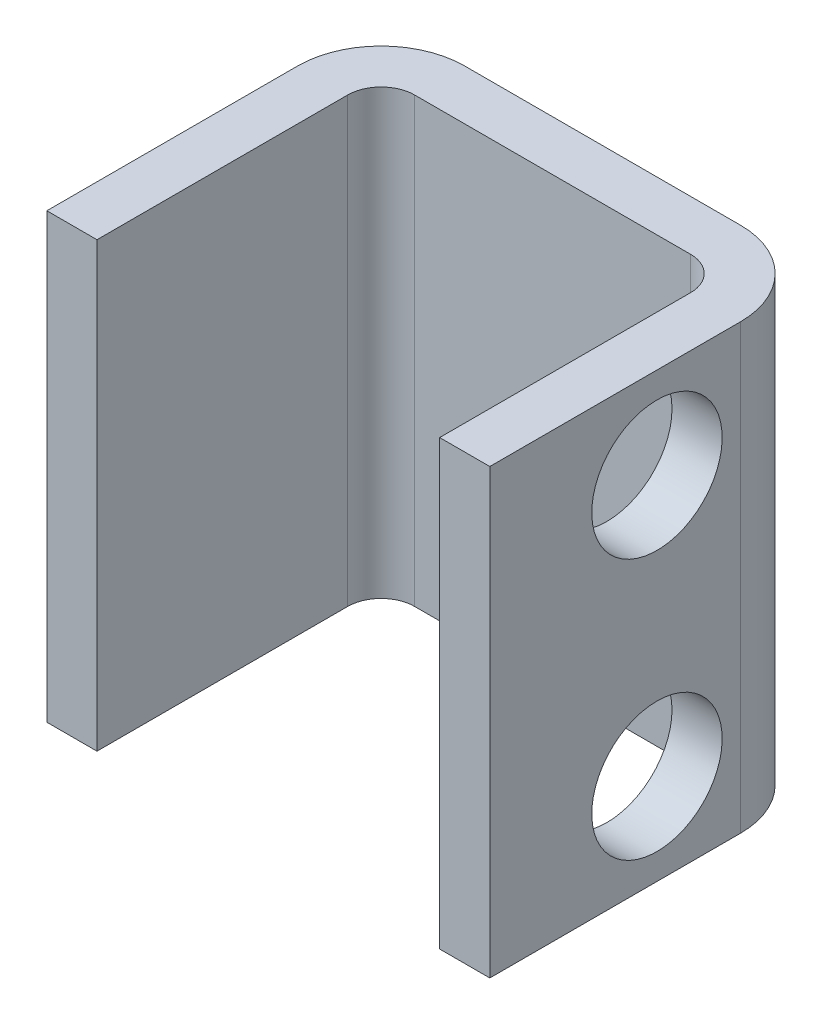
from build123d import *

# Parameters (mm, degrees)
SKETCH4_W           = 26.5
SKETCH4_H           = 26.5
BOSS_EXTRUDE2_DEPTH = 20
SHELL1_T            = -3
SKETCH6_R           = 3.9
CUT_EXTRUDE2_DEPTH  = 23.5
FILLET3_R           = 5
FILLET4_R           = 2


with BuildPart() as part:
    # Sketch4 → Boss-Extrude2 (new body)
    with BuildSketch(Plane(origin=(0, 0, 0), x_dir=(0, 1, 0), z_dir=(0, 0, 1))):
        Rectangle(SKETCH4_W, SKETCH4_H)
    extrude(amount=BOSS_EXTRUDE2_DEPTH)

    # Shell1
    shell1_openings = [part.faces().sort_by_distance(p)[0] for p in [
        (0, 0, 20),
        (0, 13.25, 10),
        (0, -13.25, 10),
    ]]
    offset(amount=SHELL1_T, openings=shell1_openings, kind=Kind.INTERSECTION)

    # Sketch6 → Cut-Extrude2 (cut)
    with BuildSketch(Plane.YZ.offset(13.25)):
        with Locations((-7.8, 10)):
            Circle(SKETCH6_R)
        with Locations((7.8, 10)):
            Circle(SKETCH6_R)
    extrude(amount=-CUT_EXTRUDE2_DEPTH, mode=Mode.SUBTRACT)

    # Fillet3
    fillet3_edges = [part.edges().sort_by_distance(p)[0] for p in [
        (-13.25, 0, 0),
        (13.25, 0, 0),
    ]]
    fillet(fillet3_edges, radius=FILLET3_R)

    # Fillet4
    fillet4_edges = [part.edges().sort_by_distance(p)[0] for p in [
        (10.25, 0, 3),
        (-10.25, 0, 3),
    ]]
    fillet(fillet4_edges, radius=FILLET4_R)


solid = part.part
